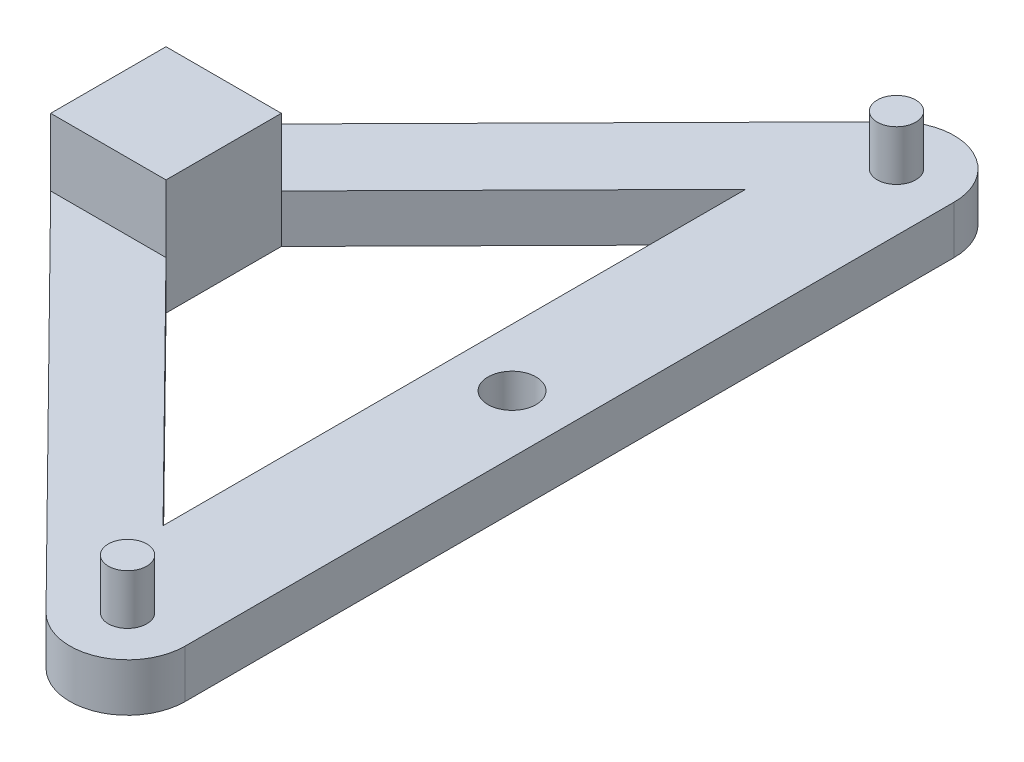
from build123d import *

# Parameters (mm, degrees)
BOSS_EXTRUDE4_DEPTH = 3.175
SKETCH11_W          = 7.62
SKETCH11_H          = 7.62
BOSS_EXTRUDE5_DEPTH = 7.62
SKETCH13_R          = 1.27
BOSS_EXTRUDE6_DEPTH = 3.302
CUT_EXTRUDE3_REACH  = 41.803
SKETCH14_R          = 1.5875
SKETCH16_R          = 1.651
CUT_EXTRUDE4_DEPTH  = 3.81


with BuildPart() as part:
    # Sketch10 → Boss-Extrude4 (new body)
    with BuildSketch(Plane(origin=(0, 0, 0), x_dir=(1, 0, 0), z_dir=(0, 1, 0))):
        with BuildLine():
            Line((-3.81, 19.245944402), (-3.81, -19.245944402))
            Line((-3.81, -19.245944402), (-19.05, -3.81))
            Line((-19.05, -3.81), (-26.67, -3.81))
            Line((-26.67, -3.81), (-2.711230101, -28.076813654))
            ThreePointArc((-2.711230101, -28.076813654), (1.44677457, -28.924619603), (3.81, -25.4))
            Line((3.81, -25.4), (3.81, 25.4))
            ThreePointArc((3.81, 25.4), (1.44677457, 28.924619603), (-2.711230101, 28.076813654))
            Line((-2.711230101, 28.076813654), (-26.67, 3.81))
            Line((-26.67, 3.81), (-19.05, 3.81))
            Line((-19.05, 3.81), (-3.81, 19.245944402))
        make_face()
    extrude(amount=BOSS_EXTRUDE4_DEPTH)

    # Sketch11 → Boss-Extrude5 (add)
    with BuildSketch(Plane(origin=(0, 0, 0), x_dir=(1, 0, 0), z_dir=(0, 1, 0))):
        with Locations((-22.86, 0)):
            Rectangle(SKETCH11_W, SKETCH11_H)
    extrude(amount=BOSS_EXTRUDE5_DEPTH)

    # Sketch13 → Boss-Extrude6 (add)
    with BuildSketch(Plane(origin=(0, 3.175, 0), x_dir=(1, 0, 0), z_dir=(0, 1, 0))):
        with Locations(Location((0, -25.4, 0), (0, 0, 90))):
            Circle(SKETCH13_R)
        with Locations(Location((0, 25.4, 0), (0, 0, 90))):
            Circle(SKETCH13_R)
    extrude(amount=BOSS_EXTRUDE6_DEPTH)

    # Sketch14 → Cut-Extrude3 (cut, up to next)
    with BuildSketch(Plane(origin=(0, 3.175, 0), x_dir=(1, 0, 0), z_dir=(0, 1, 0)), mode=Mode.PRIVATE) as cut_extrude3_sk1:
        with Locations(Location((0, 0, 0), (0, 0, 270))):
            Circle(SKETCH14_R)
    cut_extrude3_tool1 = extrude(cut_extrude3_sk1.sketch, amount=-CUT_EXTRUDE3_REACH, mode=Mode.PRIVATE) & part.part
    add(cut_extrude3_tool1.solids().sort_by_distance((0, 3.175, 0))[0], mode=Mode.SUBTRACT)

    # Sketch16 → Cut-Extrude4 (cut)
    with BuildSketch(Plane.ZY.offset(26.67)):
        with Locations((0, 3.81)):
            Circle(SKETCH16_R)
    extrude(amount=-CUT_EXTRUDE4_DEPTH, mode=Mode.SUBTRACT)


solid = part.part
